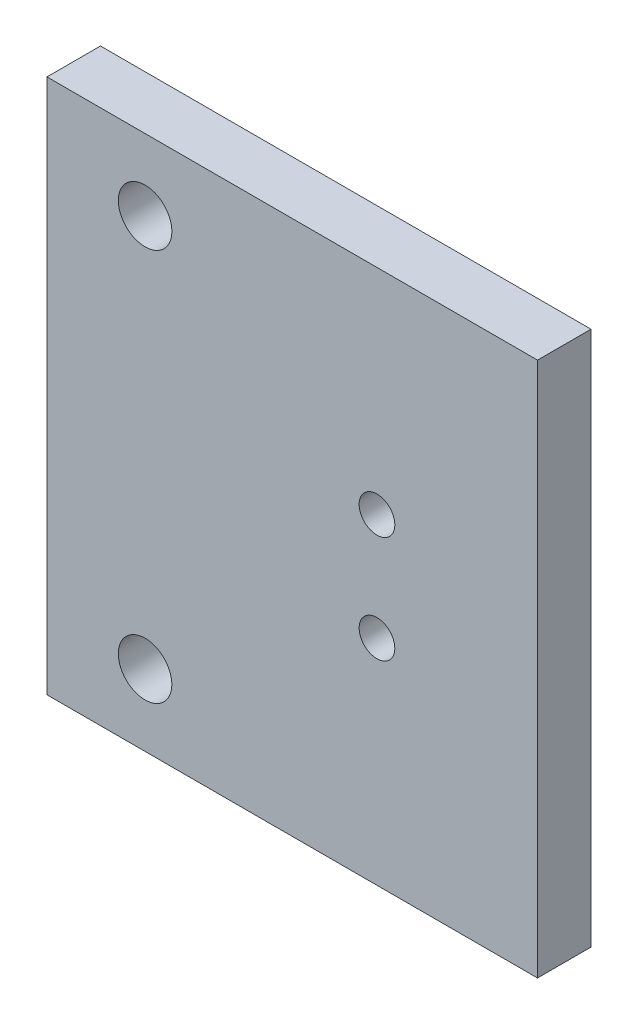
from build123d import *

# Parameters (mm, degrees)
CROQUIS1_W              = 27.5
CROQUIS1_H              = 30
CROQUIS1_R              = 1
CROQUIS1_R_2            = 1.5
SALIENTE_EXTRUIR1_DEPTH = 3


with BuildPart() as part:
    # Croquis1 → Saliente-Extruir1 (new body)
    with BuildSketch(Plane.XY):
        with Locations((13.75, 15)):
            Rectangle(CROQUIS1_W, CROQUIS1_H)
        with Locations((18.5, 12)):
            Circle(CROQUIS1_R, mode=Mode.SUBTRACT)
        with Locations((18.5, 18)):
            Circle(CROQUIS1_R, mode=Mode.SUBTRACT)
        with Locations((5.5, 4)):
            Circle(CROQUIS1_R_2, mode=Mode.SUBTRACT)
        with Locations(Location((5.5, 26, 0), (0, 0, 180))):
            Circle(CROQUIS1_R_2, mode=Mode.SUBTRACT)
    extrude(amount=SALIENTE_EXTRUIR1_DEPTH)


solid = part.part
